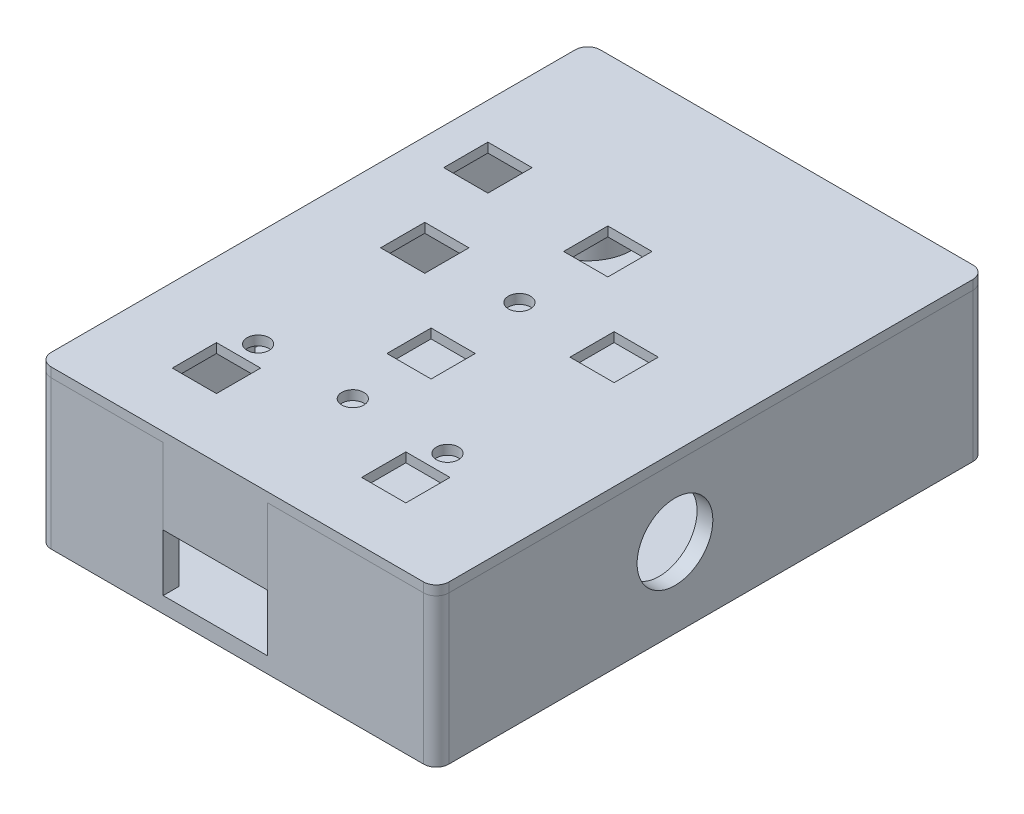
from build123d import *

# Parameters (mm, degrees)
EXTRUDE_1_DEPTH     = 2.5
SKETCH_1_4_R        = 0.75
EXTRUDE_2_DEPTH     = 3
EXTRUDE_4_DEPTH     = 4.6
EXTRUDE_START       = 21
EXTRUDE_5_DEPTH     = 21
EXTRUDE_6_DEPTH     = 9.4
CUT_EXTRUDE_1_REACH = 96.88
SKETCH_2_R          = 3.5
CUT_EXTRUDE_2_REACH = 81.387
SKETCH_3_R          = 6
SKETCH_1_8_W        = 2.5
SKETCH_1_8_H        = 12
EXTRUDE_11_DEPTH    = 7
SKETCH_4_W          = 7
SKETCH_4_H          = 7
SKETCH_4_R          = 1.75
EXTRUDE_7_DEPTH     = 1.5
SKETCH_4_4_W        = 16.5
SKETCH_4_4_H        = 2.5
EXTRUDE_8_DEPTH     = 12
EXTRUDE_9_DEPTH     = 11.5
SKETCH_5_R          = 3.5
CUT_EXTRUDE_3_DEPTH = 2.5
EXTRUDE_10_DEPTH    = 4.4
SKETCH_4_7_W        = 2.5
SKETCH_4_7_H        = 12
EXTRUDE_12_DEPTH    = 8.6
EXTRUDE_START_2     = -4
SKETCH_4_8_R        = 0.75
EXTRUDE_13_DEPTH    = 4


with BuildPart() as part:
    # 草图1 → 凸台-拉伸1 (new body)
    with BuildSketch(Plane(origin=(0, 0, 0), x_dir=(1, 0, 0), z_dir=(0, 1, 0))):
        with BuildLine():
            Line((-29.5, 43.5), (29.5, 43.5))
            ThreePointArc((29.5, 43.5), (30.914213562, 42.914213562), (31.5, 41.5))
            Line((31.5, 41.5), (31.5, -41.5))
            ThreePointArc((31.5, -41.5), (30.914213562, -42.914213562), (29.5, -43.5))
            Line((29.5, -43.5), (-29.5, -43.5))
            ThreePointArc((-29.5, -43.5), (-30.914213562, -42.914213562), (-31.5, -41.5))
            Line((-31.5, -41.5), (-31.5, 41.5))
            ThreePointArc((-31.5, 41.5), (-30.914213562, 42.914213562), (-29.5, 43.5))
        make_face()
    extrude(amount=-EXTRUDE_1_DEPTH)

    # 草图1<4> → 凸台-拉伸2 (add)
    # profile 1 of 4: a face of its own
    with BuildSketch(Plane(origin=(0, 0, 0), x_dir=(1, 0, 0), z_dir=(0, 1, 0))):
        with BuildLine():
            Line((-29, 41), (-29, 34))
            ThreePointArc((-29, 34), (-24.050252532, 36.050252532), (-22, 41))
            Line((-22, 41), (-23.35, 41))
            Line((-23.35, 41), (-29, 41))
        make_face()
        with Locations(Location((-26, 38, 0), (0, 0, 270))):
            Circle(SKETCH_1_4_R, mode=Mode.SUBTRACT)
    # profile 2 of 4: a face of its own
    with BuildSketch(Plane(origin=(0, 0, 0), x_dir=(1, 0, 0), z_dir=(0, 1, 0))):
        with BuildLine():
            ThreePointArc((22, 41), (24.050252532, 36.050252532), (29, 34))
            Line((29, 34), (29, 41))
            Line((29, 41), (23.65, 41))
            Line((23.65, 41), (22, 41))
        make_face()
        with Locations(Location((26, 38, 0), (0, 0, 270))):
            Circle(SKETCH_1_4_R, mode=Mode.SUBTRACT)
    # profile 3 of 4: a face of its own
    with BuildSketch(Plane(origin=(0, 0, 0), x_dir=(1, 0, 0), z_dir=(0, 1, 0))):
        with BuildLine():
            ThreePointArc((29, -34), (24.050252532, -36.050252532), (22, -41))
            Line((22, -41), (29, -41))
            Line((29, -41), (29, -34))
        make_face()
        with Locations(Location((26, -38, 0), (0, 0, 270))):
            Circle(SKETCH_1_4_R, mode=Mode.SUBTRACT)
    # profile 4 of 4: a face of its own
    with BuildSketch(Plane(origin=(0, 0, 0), x_dir=(1, 0, 0), z_dir=(0, 1, 0))):
        with BuildLine():
            Line((-29, -41), (-22, -41))
            ThreePointArc((-22, -41), (-24.050252532, -36.050252532), (-29, -34))
            Line((-29, -34), (-29, -41))
        make_face()
        with Locations(Location((-26, -38, 0), (0, 0, 270))):
            Circle(SKETCH_1_4_R, mode=Mode.SUBTRACT)
    extrude(amount=EXTRUDE_2_DEPTH)



with BuildPart() as body_2:
    # 草图1<5> → 凸台-拉伸4 (new body)
    with BuildSketch(Plane(origin=(0, 0, 0), x_dir=(1, 0, 0), z_dir=(0, 1, 0))):
        Polygon((-16.35, 41), (22, 41), (23.65, 41), (23.65, 43.5), (-16.35, 43.5), align=None)
    extrude(amount=EXTRUDE_4_DEPTH)


with BuildPart() as part_1:
    add(part.part)

    add(body_2.part)  # 凸台-拉伸5 merges body 2
    # 草图1<6> → 凸台-拉伸5 (add)
    with BuildSketch(Plane(origin=(0, 0, 0), x_dir=(1, 0, 0), z_dir=(0, 1, 0)).offset(EXTRUDE_START)):
        with BuildLine():
            Line((-11.76, -43.5), (-11.76, -41))
            Line((-11.76, -41), (-29, -41))
            Line((-29, -41), (-29, -11.68))
            Line((-29, -11.68), (-31.5, -11.68))
            Line((-31.5, -11.68), (-31.5, -41.5))
            ThreePointArc((-31.5, -41.5), (-30.914213562, -42.914213562), (-29.5, -43.5))
            Line((-29.5, -43.5), (-11.76, -43.5))
        make_face()
        with BuildLine():
            Line((29, -41), (4.74, -41))
            Line((4.74, -41), (4.74, -43.5))
            Line((4.74, -43.5), (29.5, -43.5))
            ThreePointArc((29.5, -43.5), (30.914213562, -42.914213562), (31.5, -41.5))
            Line((31.5, -41.5), (31.5, 41.5))
            ThreePointArc((31.5, 41.5), (30.914213562, 42.914213562), (29.5, 43.5))
            Line((29.5, 43.5), (23.65, 43.5))
            Line((23.65, 43.5), (23.65, 41))
            Line((23.65, 41), (29, 41))
            Line((29, 41), (29, -41))
        make_face()
        with BuildLine():
            Line((-31.5, 0.32), (-29, 0.32))
            Line((-29, 0.32), (-29, 41))
            Line((-29, 41), (-23.35, 41))
            Line((-23.35, 41), (-23.35, 43.5))
            Line((-23.35, 43.5), (-29.5, 43.5))
            ThreePointArc((-29.5, 43.5), (-30.914213562, 42.914213562), (-31.5, 41.5))
            Line((-31.5, 41.5), (-31.5, 0.32))
        make_face()
    extrude(amount=-EXTRUDE_5_DEPTH)

    # 草图1<7> → 凸台-拉伸6 (add)
    with BuildSketch(Plane(origin=(0, 0, 0), x_dir=(1, 0, 0), z_dir=(0, 1, 0))):
        Polygon((-23.35, 41), (-22, 41), (-16.35, 41), (-16.35, 43.5), (-23.35, 43.5), align=None)
    extrude(amount=EXTRUDE_6_DEPTH)

    # 草图2 → 切除-拉伸1 (cut, up to next)
    with BuildSketch(Plane(origin=(0, 0, -43.5), x_dir=(-1, 0, 0), z_dir=(0, 0, -1)), mode=Mode.PRIVATE) as cut_extrude_1_sk1:
        with Locations((19.85, 9.4)):
            Circle(SKETCH_2_R)
    cut_extrude_1_tool1 = extrude(cut_extrude_1_sk1.sketch, amount=-CUT_EXTRUDE_1_REACH, mode=Mode.PRIVATE) & part_1.part
    add(cut_extrude_1_tool1.solids().sort_by_distance((-19.85, 9.4, -43.5))[0], mode=Mode.SUBTRACT)

    # 草图3 → 切除-拉伸2 (cut, up to next)
    with BuildSketch(Plane(origin=(31.5, 0, 0), x_dir=(0, 0, -1), z_dir=(1, 0, 0)), mode=Mode.PRIVATE) as cut_extrude_2_sk1:
        with Locations((-5.68, 10.1)):
            Circle(SKETCH_3_R)
    cut_extrude_2_tool1 = extrude(cut_extrude_2_sk1.sketch, amount=-CUT_EXTRUDE_2_REACH, mode=Mode.PRIVATE) & part_1.part
    add(cut_extrude_2_tool1.solids().sort_by_distance((31.5, 10.1, 5.68))[0], mode=Mode.SUBTRACT)

    # 草图1<8> → 凸台-拉伸11 (add)
    with BuildSketch(Plane(origin=(0, 0, 0), x_dir=(1, 0, 0), z_dir=(0, 1, 0))):
        with Locations((-30.25, -5.68)):
            Rectangle(SKETCH_1_8_W, SKETCH_1_8_H)
    extrude(amount=EXTRUDE_11_DEPTH)


with BuildPart() as body_2_2:
    # 草图4 → 凸台-拉伸7 (new body)
    with BuildSketch(Plane(origin=(0, 21, 0), x_dir=(1, 0, 0), z_dir=(0, 1, 0))):
        with BuildLine():
            ThreePointArc((-31.5, -41.5), (-30.914213562, -42.914213562), (-29.5, -43.5))
            Line((-29.5, -43.5), (29.5, -43.5))
            ThreePointArc((29.5, -43.5), (30.914213562, -42.914213562), (31.5, -41.5))
            Line((31.5, -41.5), (31.5, 41.5))
            ThreePointArc((31.5, 41.5), (30.914213562, 42.914213562), (29.5, 43.5))
            Line((29.5, 43.5), (-29.5, 43.5))
            ThreePointArc((-29.5, 43.5), (-30.914213562, 42.914213562), (-31.5, 41.5))
            Line((-31.5, 41.5), (-31.5, -41.5))
        make_face()
        with Locations((13.75, 2.43)):
            Rectangle(SKETCH_4_W, SKETCH_4_H, mode=Mode.SUBTRACT)
        with Locations((-16.25, -30.57)):
            Rectangle(SKETCH_4_W, SKETCH_4_H, mode=Mode.SUBTRACT)
        with Locations(Location((-16.25, -23.97, 0), (0, 0, 270))):
            Circle(SKETCH_4_R, mode=Mode.SUBTRACT)
        with Locations(Location((-1.25, -23.97, 0), (0, 0, 270))):
            Circle(SKETCH_4_R, mode=Mode.SUBTRACT)
        with Locations((-1.25, -11.57)):
            Rectangle(SKETCH_4_W, SKETCH_4_H, mode=Mode.SUBTRACT)
        with Locations((13.75, -30.57)):
            Rectangle(SKETCH_4_W, SKETCH_4_H, mode=Mode.SUBTRACT)
        with Locations(Location((13.75, -23.97, 0), (0, 0, 270))):
            Circle(SKETCH_4_R, mode=Mode.SUBTRACT)
        with Locations((-16.25, 2.43)):
            Rectangle(SKETCH_4_W, SKETCH_4_H, mode=Mode.SUBTRACT)
        with Locations((-22.25, 18.43)):
            Rectangle(SKETCH_4_W, SKETCH_4_H, mode=Mode.SUBTRACT)
        with Locations(Location((-1.25, 2.43, 0), (0, 0, 270))):
            Circle(SKETCH_4_R, mode=Mode.SUBTRACT)
        with Locations((-1.25, 16.43)):
            Rectangle(SKETCH_4_W, SKETCH_4_H, mode=Mode.SUBTRACT)
    extrude(amount=EXTRUDE_7_DEPTH)

    # 草图4<4> → 凸台-拉伸8 (add)
    with BuildSketch(Plane(origin=(0, 21, 0), x_dir=(1, 0, 0), z_dir=(0, 1, 0))):
        with Locations((-3.51, -42.25)):
            Rectangle(SKETCH_4_4_W, SKETCH_4_4_H)
    extrude(amount=-EXTRUDE_8_DEPTH)

    # 草图4<5> → 凸台-拉伸9 (add)
    with BuildSketch(Plane(origin=(0, 21, 0), x_dir=(1, 0, 0), z_dir=(0, 1, 0))):
        Polygon((-23.35, 41), (-22, 41), (-16.35, 41), (-16.35, 43.5), (-23.35, 43.5), align=None)
    extrude(amount=-EXTRUDE_9_DEPTH)

    # 草图5 → 切除-拉伸3 (cut)
    with BuildSketch(Plane(origin=(0, 0, -43.5), x_dir=(-1, 0, 0), z_dir=(0, 0, -1))):
        with Locations((19.85, 9.5)):
            Circle(SKETCH_5_R)
    extrude(amount=-CUT_EXTRUDE_3_DEPTH, mode=Mode.SUBTRACT)

    # 草图4<6> → 凸台-拉伸10 (add)
    with BuildSketch(Plane(origin=(0, 21, 0), x_dir=(1, 0, 0), z_dir=(0, 1, 0))):
        Polygon((-16.35, 41), (22, 41), (23.65, 41), (23.65, 43.5), (-16.35, 43.5), align=None)
    extrude(amount=-EXTRUDE_10_DEPTH)

    # 草图4<7> → 凸台-拉伸12 (add)
    with BuildSketch(Plane(origin=(0, 21, 0), x_dir=(1, 0, 0), z_dir=(0, 1, 0))):
        with Locations((-30.25, -5.68)):
            Rectangle(SKETCH_4_7_W, SKETCH_4_7_H)
    extrude(amount=-EXTRUDE_12_DEPTH)

    # 草图4<8> → 凸台-拉伸13 (add)
    # profile 1 of 8: a face of its own
    with BuildSketch(Plane(origin=(0, 21, 0), x_dir=(1, 0, 0), z_dir=(0, 1, 0)).offset(EXTRUDE_START_2)):
        with BuildLine():
            Line((-29, 41), (-29, 34))
            ThreePointArc((-29, 34), (-24.050252532, 36.050252532), (-22, 41))
            Line((-22, 41), (-23.35, 41))
            Line((-23.35, 41), (-29, 41))
        make_face()
        with Locations(Location((-26, 38, 0), (0, 0, 270))):
            Circle(SKETCH_4_8_R, mode=Mode.SUBTRACT)
    # profile 2 of 8: a face of its own
    with BuildSketch(Plane(origin=(0, 21, 0), x_dir=(1, 0, 0), z_dir=(0, 1, 0)).offset(EXTRUDE_START_2)):
        with BuildLine():
            ThreePointArc((22, 41), (24.050252532, 36.050252532), (29, 34))
            Line((29, 34), (29, 41))
            Line((29, 41), (23.65, 41))
            Line((23.65, 41), (22, 41))
        make_face()
        with Locations(Location((26, 38, 0), (0, 0, 270))):
            Circle(SKETCH_4_8_R, mode=Mode.SUBTRACT)
    # profile 3 of 8: a face of its own
    with BuildSketch(Plane(origin=(0, 21, 0), x_dir=(1, 0, 0), z_dir=(0, 1, 0)).offset(EXTRUDE_START_2)):
        with BuildLine():
            ThreePointArc((29, -34), (24.050252532, -36.050252532), (22, -41))
            Line((22, -41), (29, -41))
            Line((29, -41), (29, -34))
        make_face()
        with Locations(Location((26, -38, 0), (0, 0, 270))):
            Circle(SKETCH_4_8_R, mode=Mode.SUBTRACT)
    # profile 4 of 8: a face of its own
    with BuildSketch(Plane(origin=(0, 21, 0), x_dir=(1, 0, 0), z_dir=(0, 1, 0)).offset(EXTRUDE_START_2)):
        with BuildLine():
            Line((-29, -41), (-22, -41))
            ThreePointArc((-22, -41), (-24.050252532, -36.050252532), (-29, -34))
            Line((-29, -34), (-29, -41))
        make_face()
        with Locations(Location((-26, -38, 0), (0, 0, 270))):
            Circle(SKETCH_4_8_R, mode=Mode.SUBTRACT)
    # profile 5 of 8: a face of its own
    with BuildSketch(Plane(origin=(0, 21, 0), x_dir=(1, 0, 0), z_dir=(0, 1, 0)).offset(EXTRUDE_START_2)):
        with Locations(Location((-26, -38, 0), (0, 0, 270))):
            Circle(SKETCH_4_8_R)
    # profile 6 of 8: a face of its own
    with BuildSketch(Plane(origin=(0, 21, 0), x_dir=(1, 0, 0), z_dir=(0, 1, 0)).offset(EXTRUDE_START_2)):
        with Locations(Location((26, -38, 0), (0, 0, 270))):
            Circle(SKETCH_4_8_R)
    # profile 7 of 8: a face of its own
    with BuildSketch(Plane(origin=(0, 21, 0), x_dir=(1, 0, 0), z_dir=(0, 1, 0)).offset(EXTRUDE_START_2)):
        with Locations(Location((26, 38, 0), (0, 0, 270))):
            Circle(SKETCH_4_8_R)
    # profile 8 of 8: a face of its own
    with BuildSketch(Plane(origin=(0, 21, 0), x_dir=(1, 0, 0), z_dir=(0, 1, 0)).offset(EXTRUDE_START_2)):
        with Locations(Location((-26, 38, 0), (0, 0, 270))):
            Circle(SKETCH_4_8_R)
    extrude(amount=EXTRUDE_13_DEPTH)


solid = Compound([part_1.part, body_2_2.part])
